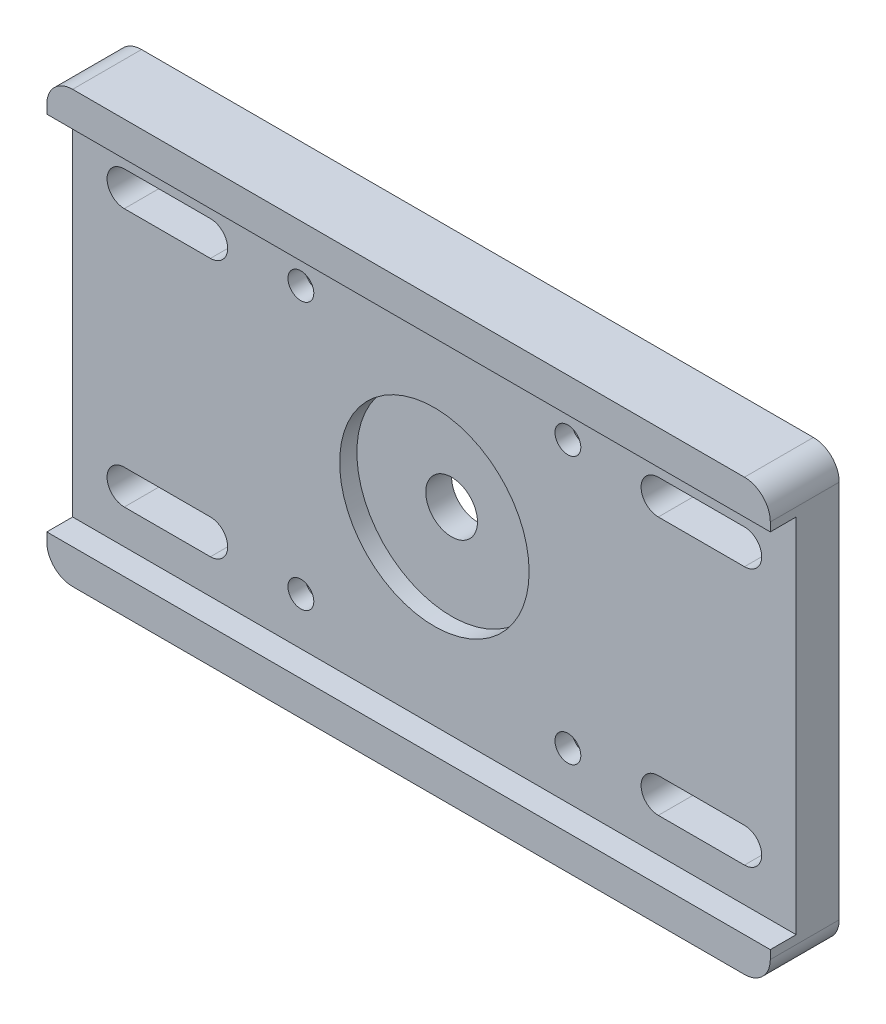
from build123d import *

# Parameters (mm, degrees)
CROQUIS1_W              = 84
CROQUIS1_H              = 50
SALIENTE_EXTRUIR1_DEPTH = 5
CORTAR_EXTRUIR5_DEPTH   = 50.132473986
CROQUIS2_R              = 3
CORTAR_EXTRUIR1_DEPTH   = 50.132473986
CROQUIS3_R              = 11
CORTAR_EXTRUIR2_DEPTH   = 2
CROQUIS4_R              = 1.5
CORTAR_EXTRUIR3_DEPTH   = 50.132473986
CROQUIS5_R              = 3.5
CORTAR_EXTRUIR4_DEPTH   = 3
CROQUIS7_W              = 84
CROQUIS7_H              = 4
SALIENTE_EXTRUIR2_DEPTH = 3
REDONDEO1_R             = 3
CHAFL_N1_SIZE           = 1


with BuildPart() as part:
    # Croquis1 → Saliente-Extruir1 (new body)
    with BuildSketch(Plane.XY):
        Rectangle(CROQUIS1_W, CROQUIS1_H)
    extrude(amount=SALIENTE_EXTRUIR1_DEPTH)

    # Croquis6 → Cortar-Extruir5 (cut, through all)
    with BuildSketch(Plane.XY.offset(5)):
        with BuildLine():
            Line((-36, 17), (-26, 17))
            ThreePointArc((-26, 17), (-24, 15), (-26, 13))
            Line((-26, 13), (-36, 13))
            ThreePointArc((-36, 13), (-38, 15), (-36, 17))
        make_face()
        with BuildLine():
            Line((36, 13), (26, 13))
            ThreePointArc((26, 13), (24, 15), (26, 17))
            Line((26, 17), (36, 17))
            ThreePointArc((36, 17), (38, 15), (36, 13))
        make_face()
        with BuildLine():
            Line((36, -17), (26, -17))
            ThreePointArc((26, -17), (24, -15), (26, -13))
            Line((26, -13), (36, -13))
            ThreePointArc((36, -13), (38, -15), (36, -17))
        make_face()
        with BuildLine():
            Line((-36, -13), (-26, -13))
            ThreePointArc((-26, -13), (-24, -15), (-26, -17))
            Line((-26, -17), (-36, -17))
            ThreePointArc((-36, -17), (-38, -15), (-36, -13))
        make_face()
    extrude(amount=-CORTAR_EXTRUIR5_DEPTH, mode=Mode.SUBTRACT)

    # Croquis2 → Cortar-Extruir1 (cut, through all)
    with BuildSketch(Plane.XY.offset(5)):
        Circle(CROQUIS2_R)
    extrude(amount=-CORTAR_EXTRUIR1_DEPTH, mode=Mode.SUBTRACT)

    # Croquis3 → Cortar-Extruir2 (cut)
    with BuildSketch(Plane.XY.offset(5)):
        Circle(CROQUIS3_R)
    extrude(amount=-CORTAR_EXTRUIR2_DEPTH, mode=Mode.SUBTRACT)

    # Croquis4 → Cortar-Extruir3 (cut, through all)
    with BuildSketch(Plane.XY.offset(5)):
        with Locations((15.5, 15.5)):
            Circle(CROQUIS4_R)
        with Locations((-15.5, 15.5)):
            Circle(CROQUIS4_R)
        with Locations((-15.5, -15.5)):
            Circle(CROQUIS4_R)
        with Locations((15.5, -15.5)):
            Circle(CROQUIS4_R)
    extrude(amount=-CORTAR_EXTRUIR3_DEPTH, mode=Mode.SUBTRACT)

    # Croquis5 → Cortar-Extruir4 (cut)
    with BuildSketch(Plane(origin=(0, 0, 0), x_dir=(-1, 0, 0), z_dir=(0, 0, -1))):
        with Locations((-15.5, 15.5)):
            Circle(CROQUIS5_R)
        with Locations((15.5, 15.5)):
            Circle(CROQUIS5_R)
        with Locations((15.5, -15.5)):
            Circle(CROQUIS5_R)
        with Locations((-15.5, -15.5)):
            Circle(CROQUIS5_R)
    extrude(amount=-CORTAR_EXTRUIR4_DEPTH, mode=Mode.SUBTRACT)

    # Croquis7 → Saliente-Extruir2 (add)
    with BuildSketch(Plane.XY.offset(5)):
        with Locations((0, 23)):
            Rectangle(CROQUIS7_W, CROQUIS7_H)
        with Locations((0, -23)):
            Rectangle(CROQUIS7_W, CROQUIS7_H)
    extrude(amount=SALIENTE_EXTRUIR2_DEPTH)

    # Redondeo1
    redondeo1_edges = [part.edges().sort_by_distance(p)[0] for p in [
        (42, -25, 4),
        (-42, -25, 4),
        (-42, 25, 4),
        (42, 25, 4),
    ]]
    fillet(redondeo1_edges, radius=REDONDEO1_R)

    # Chaflán1
    chafl_n1_edges = [part.edges().sort_by_distance(p)[0] for p in [
        (-38, 15, 0),
        (-31, 17, 0),
        (-24, 15, 0),
        (-31, 13, 0),
        (38, 15, 0),
        (31, 13, 0),
        (24, 15, 0),
        (31, 17, 0),
        (38, -15, 0),
        (31, -17, 0),
        (24, -15, 0),
        (31, -13, 0),
        (-38, -15, 0),
        (-31, -13, 0),
        (-24, -15, 0),
        (-31, -17, 0),
    ]]
    chamfer(chafl_n1_edges, length=CHAFL_N1_SIZE)


solid = part.part
